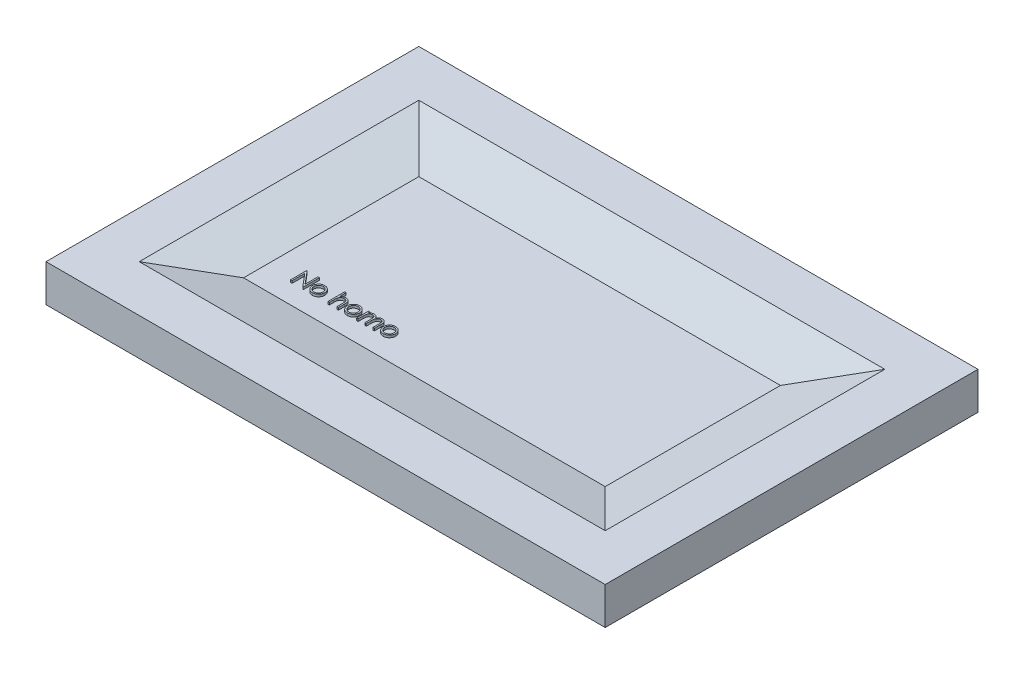
from build123d import *

# Parameters (mm, degrees)
SKETCH1_W            = 120
SKETCH1_H            = 80
BOSS_EXTRUDE1_DEPTH  = 4
CUT_EXTRUDE1_DEPTH   = 3
CUT_EXTRUDE1_DRAFT   = -75
MIRROR1_COPY_1_DEPTH = 3
MIRROR1_COPY_1_DRAFT = -75
BOSS_EXTRUDE3_DEPTH  = 0.5
BOSS_EXTRUDE6_DEPTH  = 0.5


with BuildPart() as part:
    # Sketch1 → Boss-Extrude1 (new, symmetric)
    with BuildSketch(Plane(origin=(0, 0, 0), x_dir=(1, 0, 0), z_dir=(0, 1, 0))):
        Rectangle(SKETCH1_W, SKETCH1_H)
    extrude(amount=BOSS_EXTRUDE1_DEPTH, both=True)


with BuildPart() as cut_extrude1_tool:
    # 3DSketch1 → Cut-Extrude1 (with draft: the straight prism first)
    with BuildSketch(Plane(origin=(-50, 4, 30), x_dir=(0.8574929257125441, 0, -0.5144957554275267), z_dir=(0, 1, 0))):
        Polygon((0, 0), (85.749292571, -51.449575543), (116.619037897, 0), (30.869745326, 51.449575543), align=None)
    extrude(amount=-CUT_EXTRUDE1_DEPTH)
    # Cut-Extrude1: the draft: its side faces are tilted about the plane it starts from
    cut_extrude1_sides = [cut_extrude1_tool.faces().sort_by_distance(p)[0] for p in [
        (0, 2.5, 30),
        (50, 2.5, 0),
        (0, 2.5, -30),
        (-50, 2.5, 0),
    ]]
    draft(cut_extrude1_sides, Plane(origin=(-50, 4, 30), x_dir=(0.8574929257125441, 0, -0.5144957554275267), z_dir=(0, 1, 0)), CUT_EXTRUDE1_DRAFT)


with BuildPart() as part_1:
    add(part.part)

    # Cut-Extrude1: cut by cut_extrude1_tool
    add(cut_extrude1_tool.part, mode=Mode.SUBTRACT)


with BuildPart() as mirror1_copy_1_tool:
    # Mirror1 copy 1 sketch → Mirror1 copy 1 (with draft: the straight prism first)
    with BuildSketch(Plane(origin=(-50, -4, 30), x_dir=(0.8574929257125441, 0, -0.5144957554275267), z_dir=(0, -1, 0))):
        Polygon((0, 0), (85.749292571, 51.449575543), (116.619037897, 0), (30.869745326, -51.449575543), align=None)
    extrude(amount=-MIRROR1_COPY_1_DEPTH)
    # Mirror1 copy 1: the draft: its side faces are tilted about the plane it starts from
    mirror1_copy_1_sides = [mirror1_copy_1_tool.faces().sort_by_distance(p)[0] for p in [
        (0, -2.5, 30),
        (50, -2.5, 0),
        (0, -2.5, -30),
        (-50, -2.5, 0),
    ]]
    draft(mirror1_copy_1_sides, Plane(origin=(-50, -4, 30), x_dir=(0.8574929257125441, 0, -0.5144957554275267), z_dir=(0, -1, 0)), MIRROR1_COPY_1_DRAFT)


with BuildPart() as part_2:
    add(part_1.part)

    # Mirror1 copy 1: cut by mirror1_copy_1_tool
    add(mirror1_copy_1_tool.part, mode=Mode.SUBTRACT)

    # Sketch2 → Boss-Extrude3 (add)
    # profile 1 of 6: a face of its own
    with BuildSketch(Plane(origin=(0, 1, 0), x_dir=(1, 0, 0), z_dir=(0, 1, 0))):
        Polygon((-32.885274871, -14.637435962), (-32.885274871, -11.137435962), (-32.819369422, -11.137435962), (-30.507069743, -13.892143494), (-30.507069743, -11.137435962), (-30.192967179, -11.137435962), (-30.192967179, -14.637435962), (-30.264481602, -14.637435962), (-32.571172307, -11.889038526), (-32.571172307, -14.637435962), align=None)
    # profile 2 of 6: a face of its own
    with BuildSketch(Plane(origin=(0, 1, 0), x_dir=(1, 0, 0), z_dir=(0, 1, 0))):
        with BuildLine():
            add(Edge.make_bspline(
                [(-28.149898269, -12.034871859), (-28.101906996, -12.03589375), (-28.007807838, -12.037897429), (-27.869999952, -12.059312395), (-27.738454816, -12.092059759), (-27.612668624, -12.137331321), (-27.494252329, -12.198013272), (-27.381481085, -12.270422563), (-27.274664076, -12.356205156), (-27.210641047, -12.422563225), (-27.178143461, -12.456246058)],
                knots=[0, 0, 0, 0, 1.054011418, 2.066658804, 3.057071809, 4.030435133, 4.997543892, 5.974964718, 6.972108034, 8, 8, 8, 8], degree=3))
            add(Edge.make_bspline(
                [(-27.178143461, -12.456246058), (-27.150161507, -12.488460043), (-27.094739127, -12.552264586), (-27.023673408, -12.655720199), (-26.962451848, -12.762860299), (-26.913388887, -12.875107626), (-26.874703863, -12.991482297), (-26.847238167, -13.112384308), (-26.830901232, -13.237546655), (-26.828698265, -13.322550493), (-26.827582563, -13.365601026)],
                knots=[0, 0, 0, 0, 1.025258237, 2.030674902, 3.01204498, 3.988269485, 4.97094183, 5.956517959, 6.965070386, 8, 8, 8, 8], degree=3))
            add(Edge.make_bspline(
                [(-26.827582563, -13.365601026), (-26.828563901, -13.408901083), (-26.830503069, -13.494464017), (-26.848846685, -13.620483382), (-26.877377771, -13.742678205), (-26.91820961, -13.860536899), (-26.970567719, -13.974419726), (-27.034458406, -14.083829276), (-27.110330023, -14.188981409), (-27.19633402, -14.288983247), (-27.291385896, -14.381149462), (-27.394502045, -14.461477731), (-27.503656078, -14.530299256), (-27.620299432, -14.585735671), (-27.743366919, -14.629445372), (-27.873123987, -14.660145388), (-28.009369057, -14.678707072), (-28.102396278, -14.681090645), (-28.149898269, -14.682307756)],
                knots=[0, 0, 0, 0, 0.998656419, 1.973391657, 2.932242238, 3.890759089, 4.846373663, 5.82037756, 6.809684879, 7.83454468, 8.860553229, 9.859544525, 10.845671541, 11.83227036, 12.833544569, 13.85385346, 14.904124723, 16, 16, 16, 16], degree=3))
            add(Edge.make_bspline(
                [(-28.149898269, -14.682307756), (-28.197632988, -14.68108656), (-28.291123848, -14.678694786), (-28.42784983, -14.660217503), (-28.557839449, -14.62945952), (-28.681068047, -14.585592028), (-28.798212894, -14.530297484), (-28.907999391, -14.461685794), (-29.011199307, -14.381125639), (-29.106271291, -14.288989702), (-29.192269896, -14.188979746), (-29.268142905, -14.083829707), (-29.332033231, -13.974419614), (-29.384391435, -13.860536929), (-29.425223248, -13.742678197), (-29.45375434, -13.620483385), (-29.472097955, -13.494464016), (-29.474037123, -13.408901083), (-29.475018461, -13.365601026)],
                knots=[0, 0, 0, 0, 1.099876186, 2.154163076, 3.173186993, 4.173200201, 5.163417411, 6.152872554, 7.150605724, 8.17532212, 9.198891216, 10.186952605, 11.159729845, 12.11414092, 13.071450619, 14.029093627, 15.002601286, 16, 16, 16, 16], degree=3))
            add(Edge.make_bspline(
                [(-29.475018461, -13.365601026), (-29.473895151, -13.32278448), (-29.471671189, -13.238015077), (-29.45535068, -13.113088017), (-29.427992124, -12.992390628), (-29.389260727, -12.876465152), (-29.339745536, -12.764709716), (-29.279384248, -12.657304885), (-29.207593616, -12.554317084), (-29.152391664, -12.490595004), (-29.124457563, -12.458349423)],
                knots=[0, 0, 0, 0, 1.031353054, 2.041901799, 3.029428768, 4.008703097, 4.981709435, 5.96992636, 6.972712378, 8, 8, 8, 8], degree=3))
            add(Edge.make_bspline(
                [(-29.124457563, -12.458349423), (-29.092008972, -12.424374484), (-29.028193109, -12.357556788), (-28.920844381, -12.272024263), (-28.80835056, -12.19810819), (-28.688625634, -12.138631974), (-28.562942776, -12.091793456), (-28.430723533, -12.059227941), (-28.292448018, -12.037974586), (-28.197888397, -12.035916409), (-28.149898269, -12.034871859)],
                knots=[0, 0, 0, 0, 1.027980169, 2.021703884, 2.998553061, 3.971491411, 4.943284454, 5.930300938, 6.949603206, 8, 8, 8, 8], degree=3))
        make_face()
        with BuildLine():
            add(Edge.make_bspline(
                [(-28.151300512, -12.348974423), (-28.185238124, -12.349939015), (-28.252237252, -12.351843297), (-28.350856837, -12.366327202), (-28.445796991, -12.389274706), (-28.537237835, -12.421878762), (-28.624871007, -12.463977661), (-28.70878041, -12.515686021), (-28.78921285, -12.576318978), (-28.864594913, -12.64578165), (-28.933777225, -12.721660644), (-28.994255202, -12.802509003), (-29.045680308, -12.887015349), (-29.088520467, -12.97526756), (-29.120427655, -13.068159974), (-29.143600678, -13.164640605), (-29.158070918, -13.264906022), (-29.159957297, -13.33306704), (-29.160915897, -13.367704391)],
                knots=[0, 0, 0, 0, 1.021534396, 2.016698045, 2.994645724, 3.958388632, 4.93408049, 5.916473867, 6.921342795, 7.962252576, 8.998418191, 10.008913653, 10.997312074, 11.973003931, 12.956656626, 13.948281152, 14.957379055, 16, 16, 16, 16], degree=3))
            add(Edge.make_bspline(
                [(-29.160915897, -13.367704391), (-29.159309073, -13.412456418), (-29.156119829, -13.501280824), (-29.130184592, -13.632091946), (-29.086798312, -13.757673798), (-29.028211033, -13.877290184), (-28.954804814, -13.987962463), (-28.868317747, -14.086633947), (-28.769678047, -14.171819758), (-28.660061547, -14.242500604), (-28.541707229, -14.29866036), (-28.416450908, -14.338459335), (-28.285810214, -14.364331028), (-28.196529483, -14.366902502), (-28.151300512, -14.368205192)],
                knots=[0, 0, 0, 0, 1.016792936, 2.018143844, 3.017858371, 4.030088057, 5.03801393, 6.028138512, 7.003788237, 7.991172063, 8.984598303, 9.972568034, 10.972917682, 12, 12, 12, 12], degree=3))
            add(Edge.make_bspline(
                [(-28.151300512, -14.368205192), (-28.106074143, -14.366894912), (-28.016798547, -14.364308455), (-27.88633937, -14.338589635), (-27.761425399, -14.298485975), (-27.643194011, -14.242563765), (-27.533627408, -14.17155135), (-27.434278286, -14.087114973), (-27.348529675, -13.987701122), (-27.27519607, -13.877143593), (-27.215649328, -13.757859241), (-27.172466126, -13.632068768), (-27.14646854, -13.501286727), (-27.143287711, -13.412458396), (-27.141685128, -13.367704391)],
                knots=[0, 0, 0, 0, 1.02726834, 2.027799167, 3.010890988, 4.004497153, 4.992059811, 5.971914811, 6.958719428, 7.966827853, 8.981595046, 9.981490638, 10.983022906, 12, 12, 12, 12], degree=3))
            add(Edge.make_bspline(
                [(-27.141685128, -13.367704391), (-27.142643398, -13.333066833), (-27.144529127, -13.264905408), (-27.159004091, -13.164642954), (-27.182159631, -13.068151357), (-27.214131248, -12.975299354), (-27.256785262, -12.88678685), (-27.309202055, -12.802757123), (-27.36943308, -12.721380577), (-27.439450201, -12.646026936), (-27.514753579, -12.576291899), (-27.595218617, -12.51566251), (-27.679003596, -12.464204914), (-27.766382179, -12.421518674), (-27.857834746, -12.389571334), (-27.952641875, -12.366194702), (-28.050840685, -12.351904505), (-28.117599728, -12.349957364), (-28.151300512, -12.348974423)],
                knots=[0, 0, 0, 0, 1.042956736, 2.052379634, 3.044323526, 4.02829302, 5.004299113, 5.996692471, 7.007513377, 8.048758398, 9.090003419, 10.095195979, 11.07790575, 12.047570684, 13.018257071, 13.989683339, 14.985167495, 16, 16, 16, 16], degree=3))
        make_face(mode=Mode.SUBTRACT)
    # profile 3 of 6: a face of its own
    with BuildSketch(Plane(origin=(0, 1, 0), x_dir=(1, 0, 0), z_dir=(0, 1, 0))):
        with BuildLine():
            Line((-24.853223589, -11.047692372), (-24.539121025, -11.047692372))
            Line((-24.539121025, -11.047692372), (-24.539121025, -12.56281657))
            add(Edge.make_bspline(
                [(-24.539121025, -12.56281657), (-24.505403723, -12.520672588), (-24.439754409, -12.438616096), (-24.329258293, -12.331554905), (-24.215787421, -12.238756284), (-24.095422611, -12.164885826), (-23.97037209, -12.106529283), (-23.840108446, -12.065141637), (-23.704607475, -12.03969054), (-23.612582325, -12.036492122), (-23.565963974, -12.034871859)],
                knots=[0, 0, 0, 0, 1.125788106, 2.19196713, 3.20547328, 4.180437432, 5.132270164, 6.079753143, 7.027236121, 8, 8, 8, 8], degree=3))
            add(Edge.make_bspline(
                [(-23.565963974, -12.034871859), (-23.518633581, -12.036617289), (-23.425996585, -12.040033517), (-23.291115123, -12.067046898), (-23.165154248, -12.113204336), (-23.048488405, -12.176371361), (-22.943663708, -12.255044189), (-22.850813944, -12.345875711), (-22.774973145, -12.451149629), (-22.723374028, -12.548405883), (-22.68980062, -12.634944637), (-22.668548794, -12.70918115), (-22.650529595, -12.791903063), (-22.63482986, -12.883067795), (-22.624366278, -12.983112967), (-22.61596166, -13.091587221), (-22.609985206, -13.208484339), (-22.609753601, -13.289404588), (-22.609633846, -13.331246058)],
                knots=[0, 0, 0, 0, 1.235656852, 2.418478516, 3.575258207, 4.727955599, 5.870717718, 6.98870536, 8.107142894, 9.245821548, 9.854588956, 10.528768408, 11.260415777, 12.065282286, 12.943670737, 13.886611085, 14.907229059, 16, 16, 16, 16], degree=3))
            Line((-22.609633846, -13.331246058), (-22.609633846, -14.637435962))
            Line((-22.609633846, -14.637435962), (-22.92373641, -14.637435962))
            Line((-22.92373641, -14.637435962), (-22.92373641, -13.434310962))
            add(Edge.make_bspline(
                [(-22.92373641, -13.434310962), (-22.923926713, -13.399488292), (-22.92429073, -13.332878452), (-22.925494075, -13.237512343), (-22.92818029, -13.151016209), (-22.932521116, -13.073667257), (-22.937086423, -13.005357654), (-22.943369741, -12.946186599), (-22.950679975, -12.896072824), (-22.957248756, -12.865908195), (-22.960194743, -12.852379872)],
                knots=[0, 0, 0, 0, 1.430932559, 2.737130458, 3.918967929, 4.986496826, 5.920444988, 6.731744033, 7.431208747, 8, 8, 8, 8], degree=3))
            add(Edge.make_bspline(
                [(-22.960194743, -12.852379872), (-22.971618988, -12.812685608), (-22.993582033, -12.736373617), (-23.04463001, -12.632711207), (-23.108389021, -12.544326467), (-23.186236283, -12.472412178), (-23.276794647, -12.416000639), (-23.380654611, -12.376932857), (-23.496838679, -12.352685135), (-23.578690151, -12.350245831), (-23.621352596, -12.348974423)],
                knots=[0, 0, 0, 0, 1.090059168, 2.095632401, 3.037101401, 3.955032261, 4.878929692, 5.839099886, 6.873700383, 8, 8, 8, 8], degree=3))
            add(Edge.make_bspline(
                [(-23.621352596, -12.348974423), (-23.646620369, -12.349450249), (-23.696624639, -12.350391897), (-23.770773305, -12.359845796), (-23.842702368, -12.375294514), (-23.913104546, -12.396199053), (-23.980487744, -12.42464459), (-24.046816069, -12.457574779), (-24.110210278, -12.497883034), (-24.171796095, -12.543108801), (-24.229113628, -12.593178561), (-24.282440743, -12.646025516), (-24.329979084, -12.70230048), (-24.373047675, -12.761100596), (-24.41022596, -12.82323239), (-24.442679042, -12.888096708), (-24.470214739, -12.955778854), (-24.483897431, -13.002753916), (-24.490743621, -13.026258077)],
                knots=[0, 0, 0, 0, 1.024319606, 2.027102035, 3.025350316, 4.005802111, 5.00026367, 5.987881639, 7.005602596, 8.042517216, 9.083927026, 10.089214625, 11.084353441, 12.06828073, 13.041928858, 14.016821737, 15.00770877, 16, 16, 16, 16], degree=3))
            add(Edge.make_bspline(
                [(-24.490743621, -13.026258077), (-24.494683048, -13.043279028), (-24.503267545, -13.080369775), (-24.512582379, -13.141544099), (-24.520920175, -13.212630471), (-24.527968725, -13.293521071), (-24.532291811, -13.384512313), (-24.536950052, -13.484983272), (-24.538684066, -13.595563293), (-24.538971019, -13.672458801), (-24.539121025, -13.712656314)],
                knots=[0, 0, 0, 0, 0.607992626, 1.324890765, 2.152360218, 3.099583803, 4.150613268, 5.323148443, 6.60066238, 8, 8, 8, 8], degree=3))
            Line((-24.539121025, -13.712656314), (-24.539121025, -14.637435962))
            Line((-24.539121025, -14.637435962), (-24.853223589, -14.637435962))
            Line((-24.853223589, -14.637435962), (-24.853223589, -11.047692372))
        make_face()
    # profile 4 of 6: a face of its own
    with BuildSketch(Plane(origin=(0, 1, 0), x_dir=(1, 0, 0), z_dir=(0, 1, 0))):
        with BuildLine():
            add(Edge.make_bspline(
                [(-20.656308525, -12.034871859), (-20.608317252, -12.03589375), (-20.514218095, -12.037897429), (-20.376410209, -12.059312395), (-20.244865073, -12.092059759), (-20.119078881, -12.137331321), (-20.000662585, -12.198013272), (-19.887891341, -12.270422563), (-19.781074332, -12.356205156), (-19.717051303, -12.422563225), (-19.684553717, -12.456246058)],
                knots=[0, 0, 0, 0, 1.054011418, 2.066658804, 3.057071809, 4.030435133, 4.997543892, 5.974964718, 6.972108034, 8, 8, 8, 8], degree=3))
            add(Edge.make_bspline(
                [(-19.684553717, -12.456246058), (-19.656571763, -12.488460043), (-19.601149383, -12.552264586), (-19.530083664, -12.655720199), (-19.468862104, -12.762860299), (-19.419799143, -12.875107626), (-19.381114119, -12.991482297), (-19.353648423, -13.112384308), (-19.337311488, -13.237546655), (-19.335108521, -13.322550493), (-19.33399282, -13.365601026)],
                knots=[0, 0, 0, 0, 1.025258237, 2.030674902, 3.01204498, 3.988269485, 4.97094183, 5.956517959, 6.965070386, 8, 8, 8, 8], degree=3))
            add(Edge.make_bspline(
                [(-19.33399282, -13.365601026), (-19.334974157, -13.408901083), (-19.336913326, -13.494464017), (-19.355256942, -13.620483382), (-19.383788028, -13.742678205), (-19.424619866, -13.860536899), (-19.476977975, -13.974419726), (-19.540868663, -14.083829276), (-19.61674028, -14.188981409), (-19.702744277, -14.288983247), (-19.797796153, -14.381149462), (-19.900912301, -14.461477731), (-20.010066335, -14.530299256), (-20.126709688, -14.585735671), (-20.249777175, -14.629445372), (-20.379534243, -14.660145388), (-20.515779313, -14.678707072), (-20.608806535, -14.681090645), (-20.656308525, -14.682307756)],
                knots=[0, 0, 0, 0, 0.998656419, 1.973391657, 2.932242238, 3.890759089, 4.846373663, 5.82037756, 6.809684879, 7.83454468, 8.860553229, 9.859544525, 10.845671541, 11.83227036, 12.833544569, 13.85385346, 14.904124723, 16, 16, 16, 16], degree=3))
            add(Edge.make_bspline(
                [(-20.656308525, -14.682307756), (-20.704043245, -14.68108656), (-20.797534104, -14.678694786), (-20.934260086, -14.660217503), (-21.064249705, -14.62945952), (-21.187478304, -14.585592028), (-21.304623151, -14.530297484), (-21.414409648, -14.461685794), (-21.517609563, -14.381125639), (-21.612681547, -14.288989702), (-21.698680153, -14.188979746), (-21.774553161, -14.083829707), (-21.838443487, -13.974419614), (-21.890801691, -13.860536929), (-21.931633504, -13.742678197), (-21.960164597, -13.620483385), (-21.978508211, -13.494464016), (-21.98044738, -13.408901083), (-21.981428717, -13.365601026)],
                knots=[0, 0, 0, 0, 1.099876186, 2.154163076, 3.173186993, 4.173200201, 5.163417411, 6.152872554, 7.150605724, 8.17532212, 9.198891216, 10.186952605, 11.159729845, 12.11414092, 13.071450619, 14.029093627, 15.002601286, 16, 16, 16, 16], degree=3))
            add(Edge.make_bspline(
                [(-21.981428717, -13.365601026), (-21.980305407, -13.32278448), (-21.978081446, -13.238015077), (-21.961760936, -13.113088017), (-21.93440238, -12.992390628), (-21.895670984, -12.876465152), (-21.846155793, -12.764709716), (-21.785794505, -12.657304885), (-21.714003872, -12.554317084), (-21.658801921, -12.490595004), (-21.63086782, -12.458349423)],
                knots=[0, 0, 0, 0, 1.031353054, 2.041901799, 3.029428768, 4.008703097, 4.981709435, 5.96992636, 6.972712378, 8, 8, 8, 8], degree=3))
            add(Edge.make_bspline(
                [(-21.63086782, -12.458349423), (-21.598419229, -12.424374484), (-21.534603365, -12.357556788), (-21.427254637, -12.272024263), (-21.314760816, -12.19810819), (-21.19503589, -12.138631974), (-21.069353032, -12.091793456), (-20.93713379, -12.059227941), (-20.798858274, -12.037974586), (-20.704298653, -12.035916409), (-20.656308525, -12.034871859)],
                knots=[0, 0, 0, 0, 1.027980169, 2.021703884, 2.998553061, 3.971491411, 4.943284454, 5.930300938, 6.949603206, 8, 8, 8, 8], degree=3))
        make_face()
        with BuildLine():
            add(Edge.make_bspline(
                [(-20.657710769, -12.348974423), (-20.69164838, -12.349939015), (-20.758647509, -12.351843297), (-20.857267093, -12.366327202), (-20.952207247, -12.389274706), (-21.043648091, -12.421878762), (-21.131281264, -12.463977661), (-21.215190666, -12.515686021), (-21.295623106, -12.576318978), (-21.371005169, -12.64578165), (-21.440187482, -12.721660644), (-21.500665458, -12.802509003), (-21.552090565, -12.887015349), (-21.594930724, -12.97526756), (-21.626837912, -13.068159974), (-21.650010934, -13.164640605), (-21.664481175, -13.264906022), (-21.666367553, -13.33306704), (-21.667326153, -13.367704391)],
                knots=[0, 0, 0, 0, 1.021534396, 2.016698045, 2.994645724, 3.958388632, 4.93408049, 5.916473867, 6.921342795, 7.962252576, 8.998418191, 10.008913653, 10.997312074, 11.973003931, 12.956656626, 13.948281152, 14.957379055, 16, 16, 16, 16], degree=3))
            add(Edge.make_bspline(
                [(-21.667326153, -13.367704391), (-21.66571933, -13.412456418), (-21.662530085, -13.501280824), (-21.636594849, -13.632091946), (-21.593208569, -13.757673798), (-21.534621289, -13.877290184), (-21.46121507, -13.987962463), (-21.374728004, -14.086633947), (-21.276088303, -14.171819758), (-21.166471803, -14.242500604), (-21.048117485, -14.29866036), (-20.922861164, -14.338459335), (-20.79222047, -14.364331028), (-20.702939739, -14.366902502), (-20.657710769, -14.368205192)],
                knots=[0, 0, 0, 0, 1.016792936, 2.018143844, 3.017858371, 4.030088057, 5.03801393, 6.028138512, 7.003788237, 7.991172063, 8.984598303, 9.972568034, 10.972917682, 12, 12, 12, 12], degree=3))
            add(Edge.make_bspline(
                [(-20.657710769, -14.368205192), (-20.6124844, -14.366894912), (-20.523208804, -14.364308455), (-20.392749627, -14.338589635), (-20.267835655, -14.298485975), (-20.149604267, -14.242563765), (-20.040037664, -14.17155135), (-19.940688543, -14.087114973), (-19.854939932, -13.987701122), (-19.781606327, -13.877143593), (-19.722059584, -13.757859241), (-19.678876382, -13.632068768), (-19.652878796, -13.501286727), (-19.649697968, -13.412458396), (-19.648095384, -13.367704391)],
                knots=[0, 0, 0, 0, 1.02726834, 2.027799167, 3.010890988, 4.004497153, 4.992059811, 5.971914811, 6.958719428, 7.966827853, 8.981595046, 9.981490638, 10.983022906, 12, 12, 12, 12], degree=3))
            add(Edge.make_bspline(
                [(-19.648095384, -13.367704391), (-19.649053654, -13.333066833), (-19.650939383, -13.264905408), (-19.665414348, -13.164642954), (-19.688569887, -13.068151357), (-19.720541504, -12.975299354), (-19.763195518, -12.88678685), (-19.815612311, -12.802757123), (-19.875843337, -12.721380577), (-19.945860458, -12.646026936), (-20.021163836, -12.576291899), (-20.101628874, -12.51566251), (-20.185413852, -12.464204914), (-20.272792435, -12.421518674), (-20.364245003, -12.389571334), (-20.459052132, -12.366194702), (-20.557250942, -12.351904505), (-20.624009985, -12.349957364), (-20.657710769, -12.348974423)],
                knots=[0, 0, 0, 0, 1.042956736, 2.052379634, 3.044323526, 4.02829302, 5.004299113, 5.996692471, 7.007513377, 8.048758398, 9.090003419, 10.095195979, 11.07790575, 12.047570684, 13.018257071, 13.989683339, 14.985167495, 16, 16, 16, 16], degree=3))
        make_face(mode=Mode.SUBTRACT)
    # profile 5 of 6: a face of its own
    with BuildSketch(Plane(origin=(0, 1, 0), x_dir=(1, 0, 0), z_dir=(0, 1, 0))):
        with BuildLine():
            Line((-18.705787692, -12.079743654), (-18.391685128, -12.079743654))
            Line((-18.391685128, -12.079743654), (-18.391685128, -12.524254872))
            add(Edge.make_bspline(
                [(-18.391685128, -12.524254872), (-18.363401178, -12.48536727), (-18.309206418, -12.410854897), (-18.220340766, -12.312664613), (-18.131564653, -12.229336458), (-18.067631271, -12.185593586), (-18.036917499, -12.164579391)],
                knots=[0, 0, 0, 0, 1.134379233, 2.173579362, 3.122582517, 4, 4, 4, 4], degree=3))
            add(Edge.make_bspline(
                [(-18.036917499, -12.164579391), (-17.995052837, -12.144574026), (-17.912054937, -12.104912812), (-17.780635713, -12.064679253), (-17.646161043, -12.039954152), (-17.555352829, -12.036572779), (-17.50967391, -12.034871859)],
                knots=[0, 0, 0, 0, 1.014936303, 2.012140481, 3.000054389, 4, 4, 4, 4], degree=3))
            add(Edge.make_bspline(
                [(-17.50967391, -12.034871859), (-17.478780913, -12.03591715), (-17.417645334, -12.037985724), (-17.327061244, -12.051445759), (-17.239202632, -12.074711932), (-17.154588603, -12.107119256), (-17.074867923, -12.146365943), (-17.001778726, -12.192415651), (-16.936154518, -12.244112726), (-16.878028466, -12.303791659), (-16.825759441, -12.373128258), (-16.777680594, -12.453992507), (-16.733255382, -12.548200168), (-16.708634073, -12.616566709), (-16.695671506, -12.65256016)],
                knots=[0, 0, 0, 0, 1.009824226, 1.998387844, 2.986035974, 3.974953746, 4.955485308, 5.885931332, 6.793869504, 7.679848016, 8.601185859, 9.625726857, 10.749998409, 12, 12, 12, 12], degree=3))
            add(Edge.make_bspline(
                [(-16.695671506, -12.65256016), (-16.681960254, -12.627835741), (-16.654978437, -12.579181556), (-16.6096728, -12.510323294), (-16.562205004, -12.445916502), (-16.512170511, -12.385910078), (-16.459745924, -12.330600347), (-16.404684524, -12.279804445), (-16.347299742, -12.233304232), (-16.267507502, -12.178981072), (-16.163694895, -12.121279891), (-16.03280678, -12.071251447), (-15.896656609, -12.040335319), (-15.80423891, -12.036705046), (-15.757570544, -12.034871859)],
                knots=[0, 0, 0, 0, 0.86119277, 1.694706429, 2.50939023, 3.298075842, 4.073795165, 4.829715201, 5.57930267, 6.321991688, 7.768977793, 9.186738141, 10.579381044, 12, 12, 12, 12], degree=3))
            add(Edge.make_bspline(
                [(-15.757570544, -12.034871859), (-15.714689081, -12.03648908), (-15.630765895, -12.039654138), (-15.508588629, -12.064507611), (-15.394646824, -12.107185258), (-15.289169748, -12.165418895), (-15.194009935, -12.238598078), (-15.111293625, -12.325666916), (-15.041523262, -12.426009539), (-14.995944622, -12.520401528), (-14.965029358, -12.603736861), (-14.945968124, -12.674743152), (-14.929128429, -12.752894705), (-14.915147183, -12.838284966), (-14.904928631, -12.931215575), (-14.897357916, -13.03153445), (-14.892233842, -13.139319562), (-14.89187177, -13.213685062), (-14.891685128, -13.252019295)],
                knots=[0, 0, 0, 0, 1.209669288, 2.367440248, 3.500751976, 4.631527125, 5.755587489, 6.87532382, 8.007944318, 9.190864318, 9.82315674, 10.514484317, 11.263564316, 12.079023757, 12.955305781, 13.901327259, 14.918167583, 16, 16, 16, 16], degree=3))
            Line((-14.891685128, -13.252019295), (-14.891685128, -14.637435962))
            Line((-14.891685128, -14.637435962), (-15.205787692, -14.637435962))
            Line((-15.205787692, -14.637435962), (-15.205787692, -13.250617051))
            add(Edge.make_bspline(
                [(-15.205787692, -13.250617051), (-15.205865575, -13.217896477), (-15.206015254, -13.15501251), (-15.208708885, -13.064760059), (-15.2137842, -12.982491702), (-15.219718838, -12.908319614), (-15.227962648, -12.842070825), (-15.238608579, -12.783878407), (-15.249886259, -12.733284595), (-15.26862225, -12.677198548), (-15.298570142, -12.615328337), (-15.344187622, -12.548604762), (-15.401657728, -12.490523961), (-15.468017885, -12.440105645), (-15.54356633, -12.399112003), (-15.626831053, -12.369835994), (-15.717295104, -12.351713115), (-15.779917893, -12.3499071), (-15.812258044, -12.348974423)],
                knots=[0, 0, 0, 0, 1.253487763, 2.409012846, 3.458416907, 4.410876679, 5.259312806, 6.014470957, 6.676830364, 7.243083969, 8.276244668, 9.299465089, 10.325150304, 11.392391894, 12.482080715, 13.603491619, 14.762376348, 16, 16, 16, 16], degree=3))
            add(Edge.make_bspline(
                [(-15.812258044, -12.348974423), (-15.851927999, -12.35039058), (-15.93033091, -12.353189446), (-16.044776396, -12.381763319), (-16.154747413, -12.424843569), (-16.256962546, -12.487276027), (-16.350990336, -12.56208439), (-16.431889914, -12.651033986), (-16.4987221, -12.751663913), (-16.543976076, -12.844810615), (-16.572565377, -12.928480059), (-16.591442293, -13.001577431), (-16.606125684, -13.084658999), (-16.619896213, -13.17716649), (-16.628883941, -13.27973667), (-16.637052314, -13.391895071), (-16.640873176, -13.513979031), (-16.641407635, -13.598605719), (-16.641685128, -13.642544135)],
                knots=[0, 0, 0, 0, 1.090531906, 2.155305635, 3.229839962, 4.33261226, 5.44038871, 6.529323825, 7.629011124, 8.757537029, 9.370236727, 10.061839251, 10.834451254, 11.692844982, 12.636905849, 13.66920014, 14.789842145, 16, 16, 16, 16], degree=3))
            Line((-16.641685128, -13.642544135), (-16.641685128, -14.637435962))
            Line((-16.641685128, -14.637435962), (-16.955787692, -14.637435962))
            Line((-16.955787692, -14.637435962), (-16.955787692, -13.336855032))
            add(Edge.make_bspline(
                [(-16.955787692, -13.336855032), (-16.955867123, -13.300161713), (-16.95601994, -13.229567456), (-16.958696257, -13.128333781), (-16.963782879, -13.036252701), (-16.969663427, -12.953431237), (-16.978123606, -12.880019908), (-16.987733368, -12.81562515), (-16.999081978, -12.760408399), (-17.017871863, -12.699845014), (-17.046586331, -12.633124091), (-17.092774593, -12.56198307), (-17.150382174, -12.499714972), (-17.21795305, -12.446556224), (-17.293958732, -12.402614743), (-17.377942133, -12.370954991), (-17.469147045, -12.352530701), (-17.532024751, -12.350182205), (-17.56436141, -12.348974423)],
                knots=[0, 0, 0, 0, 1.320475261, 2.540461679, 3.643808994, 4.639130445, 5.527981419, 6.302341397, 6.981980563, 7.553956391, 8.582137848, 9.585246428, 10.591171744, 11.620968678, 12.668337649, 13.738356861, 14.836885341, 16, 16, 16, 16], degree=3))
            add(Edge.make_bspline(
                [(-17.56436141, -12.348974423), (-17.602377621, -12.350504883), (-17.67814258, -12.353555036), (-17.78944455, -12.381009309), (-17.896930234, -12.424013384), (-17.998884933, -12.483673203), (-18.092559081, -12.557572282), (-18.174567348, -12.644487178), (-18.243509874, -12.743336211), (-18.289241689, -12.835500728), (-18.318740163, -12.917074003), (-18.338335497, -12.98642495), (-18.355175123, -13.063425198), (-18.367689145, -13.14831231), (-18.379769561, -13.240533404), (-18.38559987, -13.340547893), (-18.391271432, -13.448269981), (-18.391543846, -13.522642526), (-18.391685128, -13.561214006)],
                knots=[0, 0, 0, 0, 1.098833095, 2.189935336, 3.297829714, 4.440610912, 5.596351641, 6.740013378, 7.886572111, 9.072425424, 9.705826452, 10.395263256, 11.156850408, 11.985370555, 12.878090359, 13.847760091, 14.883794034, 16, 16, 16, 16], degree=3))
            Line((-18.391685128, -13.561214006), (-18.391685128, -14.637435962))
            Line((-18.391685128, -14.637435962), (-18.705787692, -14.637435962))
            Line((-18.705787692, -14.637435962), (-18.705787692, -12.079743654))
        make_face()
    # profile 6 of 6: a face of its own
    with BuildSketch(Plane(origin=(0, 1, 0), x_dir=(1, 0, 0), z_dir=(0, 1, 0))):
        with BuildLine():
            add(Edge.make_bspline(
                [(-12.938359807, -12.034871859), (-12.890368534, -12.03589375), (-12.796269377, -12.037897429), (-12.658461491, -12.059312395), (-12.526916355, -12.092059759), (-12.401130163, -12.137331321), (-12.282713867, -12.198013272), (-12.169942623, -12.270422563), (-12.063125614, -12.356205156), (-11.999102585, -12.422563225), (-11.966604999, -12.456246058)],
                knots=[0, 0, 0, 0, 1.054011418, 2.066658804, 3.057071809, 4.030435133, 4.997543892, 5.974964718, 6.972108034, 8, 8, 8, 8], degree=3))
            add(Edge.make_bspline(
                [(-11.966604999, -12.456246058), (-11.938623045, -12.488460043), (-11.883200665, -12.552264586), (-11.812134946, -12.655720199), (-11.750913386, -12.762860299), (-11.701850425, -12.875107626), (-11.663165401, -12.991482297), (-11.635699705, -13.112384308), (-11.61936277, -13.237546655), (-11.617159803, -13.322550493), (-11.616044102, -13.365601026)],
                knots=[0, 0, 0, 0, 1.025258237, 2.030674902, 3.01204498, 3.988269485, 4.97094183, 5.956517959, 6.965070386, 8, 8, 8, 8], degree=3))
            add(Edge.make_bspline(
                [(-11.616044102, -13.365601026), (-11.617025439, -13.408901083), (-11.618964608, -13.494464017), (-11.637308224, -13.620483382), (-11.66583931, -13.742678205), (-11.706671148, -13.860536899), (-11.759029257, -13.974419726), (-11.822919945, -14.083829276), (-11.898791562, -14.188981409), (-11.984795559, -14.288983247), (-12.079847435, -14.381149462), (-12.182963583, -14.461477731), (-12.292117617, -14.530299256), (-12.40876097, -14.585735671), (-12.531828457, -14.629445372), (-12.661585525, -14.660145388), (-12.797830595, -14.678707072), (-12.890857817, -14.681090645), (-12.938359807, -14.682307756)],
                knots=[0, 0, 0, 0, 0.998656419, 1.973391657, 2.932242238, 3.890759089, 4.846373663, 5.82037756, 6.809684879, 7.83454468, 8.860553229, 9.859544525, 10.845671541, 11.83227036, 12.833544569, 13.85385346, 14.904124723, 16, 16, 16, 16], degree=3))
            add(Edge.make_bspline(
                [(-12.938359807, -14.682307756), (-12.986094527, -14.68108656), (-13.079585386, -14.678694786), (-13.216311368, -14.660217503), (-13.346300987, -14.62945952), (-13.469529586, -14.585592028), (-13.586674433, -14.530297484), (-13.69646093, -14.461685794), (-13.799660845, -14.381125639), (-13.89473283, -14.288989702), (-13.980731435, -14.188979746), (-14.056604443, -14.083829707), (-14.120494769, -13.974419614), (-14.172852973, -13.860536929), (-14.213684786, -13.742678197), (-14.242215879, -13.620483385), (-14.260559493, -13.494464016), (-14.262498662, -13.408901083), (-14.263479999, -13.365601026)],
                knots=[0, 0, 0, 0, 1.099876186, 2.154163076, 3.173186993, 4.173200201, 5.163417411, 6.152872554, 7.150605724, 8.17532212, 9.198891216, 10.186952605, 11.159729845, 12.11414092, 13.071450619, 14.029093627, 15.002601286, 16, 16, 16, 16], degree=3))
            add(Edge.make_bspline(
                [(-14.263479999, -13.365601026), (-14.262356689, -13.32278448), (-14.260132728, -13.238015077), (-14.243812218, -13.113088017), (-14.216453662, -12.992390628), (-14.177722266, -12.876465152), (-14.128207075, -12.764709716), (-14.067845787, -12.657304885), (-13.996055154, -12.554317084), (-13.940853203, -12.490595004), (-13.912919102, -12.458349423)],
                knots=[0, 0, 0, 0, 1.031353054, 2.041901799, 3.029428768, 4.008703097, 4.981709435, 5.96992636, 6.972712378, 8, 8, 8, 8], degree=3))
            add(Edge.make_bspline(
                [(-13.912919102, -12.458349423), (-13.880470511, -12.424374484), (-13.816654647, -12.357556788), (-13.709305919, -12.272024263), (-13.596812098, -12.19810819), (-13.477087172, -12.138631974), (-13.351404314, -12.091793456), (-13.219185072, -12.059227941), (-13.080909556, -12.037974586), (-12.986349935, -12.035916409), (-12.938359807, -12.034871859)],
                knots=[0, 0, 0, 0, 1.027980169, 2.021703884, 2.998553061, 3.971491411, 4.943284454, 5.930300938, 6.949603206, 8, 8, 8, 8], degree=3))
        make_face()
        with BuildLine():
            add(Edge.make_bspline(
                [(-12.939762051, -12.348974423), (-12.973699662, -12.349939015), (-13.040698791, -12.351843297), (-13.139318375, -12.366327202), (-13.234258529, -12.389274706), (-13.325699373, -12.421878762), (-13.413332546, -12.463977661), (-13.497241948, -12.515686021), (-13.577674388, -12.576318978), (-13.653056452, -12.64578165), (-13.722238764, -12.721660644), (-13.78271674, -12.802509003), (-13.834141847, -12.887015349), (-13.876982006, -12.97526756), (-13.908889194, -13.068159974), (-13.932062216, -13.164640605), (-13.946532457, -13.264906022), (-13.948418835, -13.33306704), (-13.949377435, -13.367704391)],
                knots=[0, 0, 0, 0, 1.021534396, 2.016698045, 2.994645724, 3.958388632, 4.93408049, 5.916473867, 6.921342795, 7.962252576, 8.998418191, 10.008913653, 10.997312074, 11.973003931, 12.956656626, 13.948281152, 14.957379055, 16, 16, 16, 16], degree=3))
            add(Edge.make_bspline(
                [(-13.949377435, -13.367704391), (-13.947770612, -13.412456418), (-13.944581367, -13.501280824), (-13.918646131, -13.632091946), (-13.875259851, -13.757673798), (-13.816672571, -13.877290184), (-13.743266352, -13.987962463), (-13.656779286, -14.086633947), (-13.558139585, -14.171819758), (-13.448523085, -14.242500604), (-13.330168767, -14.29866036), (-13.204912446, -14.338459335), (-13.074271752, -14.364331028), (-12.984991021, -14.366902502), (-12.939762051, -14.368205192)],
                knots=[0, 0, 0, 0, 1.016792936, 2.018143844, 3.017858371, 4.030088057, 5.03801393, 6.028138512, 7.003788237, 7.991172063, 8.984598303, 9.972568034, 10.972917682, 12, 12, 12, 12], degree=3))
            add(Edge.make_bspline(
                [(-12.939762051, -14.368205192), (-12.894535682, -14.366894912), (-12.805260086, -14.364308455), (-12.674800909, -14.338589635), (-12.549886937, -14.298485975), (-12.43165555, -14.242563765), (-12.322088946, -14.17155135), (-12.222739825, -14.087114973), (-12.136991214, -13.987701122), (-12.063657609, -13.877143593), (-12.004110866, -13.757859241), (-11.960927664, -13.632068768), (-11.934930078, -13.501286727), (-11.93174925, -13.412458396), (-11.930146666, -13.367704391)],
                knots=[0, 0, 0, 0, 1.02726834, 2.027799167, 3.010890988, 4.004497153, 4.992059811, 5.971914811, 6.958719428, 7.966827853, 8.981595046, 9.981490638, 10.983022906, 12, 12, 12, 12], degree=3))
            add(Edge.make_bspline(
                [(-11.930146666, -13.367704391), (-11.931104936, -13.333066833), (-11.932990665, -13.264905408), (-11.94746563, -13.164642954), (-11.970621169, -13.068151357), (-12.002592786, -12.975299354), (-12.0452468, -12.88678685), (-12.097663593, -12.802757123), (-12.157894619, -12.721380577), (-12.22791174, -12.646026936), (-12.303215118, -12.576291899), (-12.383680156, -12.51566251), (-12.467465134, -12.464204914), (-12.554843717, -12.421518674), (-12.646296285, -12.389571334), (-12.741103414, -12.366194702), (-12.839302224, -12.351904505), (-12.906061267, -12.349957364), (-12.939762051, -12.348974423)],
                knots=[0, 0, 0, 0, 1.042956736, 2.052379634, 3.044323526, 4.02829302, 5.004299113, 5.996692471, 7.007513377, 8.048758398, 9.090003419, 10.095195979, 11.07790575, 12.047570684, 13.018257071, 13.989683339, 14.985167495, 16, 16, 16, 16], degree=3))
        make_face(mode=Mode.SUBTRACT)
    extrude(amount=BOSS_EXTRUDE3_DEPTH)

    # Sketch6 → Boss-Extrude6 (add)
    # profile 1 of 6: a face of its own
    with BuildSketch(Plane.XZ.offset(1)):
        Polygon((32.099827695, 15.041086412), (32.099827695, 11.541086412), (32.033922246, 11.541086412), (29.721622567, 14.295793944), (29.721622567, 11.541086412), (29.407520002, 11.541086412), (29.407520002, 15.041086412), (29.479034426, 15.041086412), (31.785725131, 12.292688976), (31.785725131, 15.041086412), align=None)
    # profile 2 of 6: a face of its own
    with BuildSketch(Plane.XZ.offset(1)):
        with BuildLine():
            add(Edge.make_bspline(
                [(27.364451092, 12.43852231), (27.316458628, 12.439541202), (27.222357135, 12.441539001), (27.084566119, 12.462996432), (26.953172391, 12.495535257), (26.827612313, 12.541337887), (26.708924519, 12.601432725), (26.596049322, 12.674105267), (26.489212874, 12.759847183), (26.425192515, 12.826210839), (26.392696285, 12.859896508)],
                knots=[0, 0, 0, 0, 1.054042676, 2.066720093, 3.05716247, 4.025731183, 4.997454851, 5.974904663, 6.97207755, 8, 8, 8, 8], degree=3))
            add(Edge.make_bspline(
                [(26.392696285, 12.859896508), (26.36471433, 12.892110494), (26.30929195, 12.955915036), (26.238226231, 13.059370649), (26.177004671, 13.16651075), (26.12794171, 13.278758077), (26.089256687, 13.395132748), (26.06179099, 13.516034759), (26.045454055, 13.641197106), (26.043251088, 13.726200944), (26.042135387, 13.769251476)],
                knots=[0, 0, 0, 0, 1.025258237, 2.030674902, 3.01204498, 3.988269485, 4.97094183, 5.956517959, 6.965070386, 8, 8, 8, 8], degree=3))
            add(Edge.make_bspline(
                [(26.042135387, 13.769251476), (26.043116724, 13.812551534), (26.045055893, 13.898114467), (26.063399509, 14.024133832), (26.091930594, 14.146328659), (26.132762438, 14.264187339), (26.185120524, 14.378070217), (26.249011299, 14.487479574), (26.324882581, 14.592632447), (26.410887877, 14.692631416), (26.505934907, 14.784808333), (26.609068605, 14.865097847), (26.718336983, 14.934174365), (26.835231665, 14.989040327), (26.958088691, 15.033266114), (27.087689509, 15.06376264), (27.223918505, 15.082366348), (27.316947961, 15.084744079), (27.364451092, 15.085958207)],
                knots=[0, 0, 0, 0, 0.998669827, 1.973418153, 2.932281609, 3.89081133, 4.846438734, 5.82045571, 6.809776312, 7.834649874, 8.860672198, 9.859676908, 10.845817165, 11.837296335, 12.833502054, 13.853824644, 14.904110009, 16, 16, 16, 16], degree=3))
            add(Edge.make_bspline(
                [(27.364451092, 15.085958207), (27.412184676, 15.084734034), (27.505673312, 15.082336428), (27.642415267, 15.063901025), (27.772561745, 15.032940271), (27.895999913, 14.989587833), (28.012894121, 14.933723713), (28.122565975, 14.865366617), (28.225748318, 14.784767676), (28.320825148, 14.692642433), (28.406822454, 14.592629609), (28.482695797, 14.48748031), (28.546586036, 14.378070025), (28.598944263, 14.26418739), (28.63977607, 14.146328645), (28.668307164, 14.024133836), (28.686650778, 13.898114467), (28.688589947, 13.812551534), (28.689571285, 13.769251476)],
                knots=[0, 0, 0, 0, 1.099861214, 2.154133753, 3.1731438, 4.178222029, 5.163564916, 6.153006591, 7.15072618, 8.175428628, 9.198983792, 10.187031731, 11.15979573, 12.114193814, 13.071490482, 14.029120454, 15.002614863, 16, 16, 16, 16], degree=3))
            add(Edge.make_bspline(
                [(28.689571285, 13.769251476), (28.688450643, 13.726433975), (28.686231965, 13.641662681), (28.669872735, 13.516749482), (28.642705887, 13.396217501), (28.603484578, 13.280478329), (28.554512693, 13.168500786), (28.493907302, 13.060967852), (28.422154141, 12.957964297), (28.366947076, 12.894244367), (28.339010387, 12.861999874)],
                knots=[0, 0, 0, 0, 1.031377469, 2.041950136, 3.029500481, 4.003457997, 4.981637986, 5.969878303, 6.97268806, 8, 8, 8, 8], degree=3))
            add(Edge.make_bspline(
                [(28.339010387, 12.861999874), (28.306560459, 12.828027748), (28.242741966, 12.761215586), (28.135412345, 12.675642843), (28.023022699, 12.6019905), (27.903569328, 12.541925905), (27.777660121, 12.495618363), (27.645289849, 12.462844564), (27.506997301, 12.441633913), (27.412440028, 12.439569847), (27.364451092, 12.43852231)],
                knots=[0, 0, 0, 0, 1.027951202, 2.021646915, 2.998468564, 3.9668038, 4.943370589, 5.93035926, 6.949632805, 8, 8, 8, 8], degree=3))
        make_face()
        with BuildLine():
            add(Edge.make_bspline(
                [(27.365853336, 12.752624874), (27.399790909, 12.753589517), (27.466789963, 12.755493903), (27.565410096, 12.769977056), (27.66034822, 12.792927341), (27.751796548, 12.825521144), (27.839401472, 12.867658749), (27.923259063, 12.919122586), (28.003145249, 12.980186203), (28.078441595, 13.049638046), (28.148370182, 13.125068377), (28.208744047, 13.206202735), (28.26046588, 13.290786635), (28.302726847, 13.379298153), (28.335149211, 13.47198046), (28.358121479, 13.568303273), (28.372632118, 13.668553277), (28.374512943, 13.736716414), (28.37546872, 13.771354842)],
                knots=[0, 0, 0, 0, 1.021608339, 2.016844023, 2.99486249, 3.958675159, 4.934437641, 5.916902129, 6.916234728, 7.957219854, 8.998204981, 10.008773588, 10.997243553, 11.979355116, 12.956436335, 13.948132639, 14.957303585, 16, 16, 16, 16], degree=3))
            add(Edge.make_bspline(
                [(28.37546872, 13.771354842), (28.373866137, 13.816108846), (28.370685308, 13.904937177), (28.344687722, 14.035719219), (28.30150452, 14.161509691), (28.241957778, 14.280794043), (28.168624173, 14.391351572), (28.082875562, 14.490765424), (27.98352644, 14.575201801), (27.873959837, 14.646214216), (27.755728449, 14.702136425), (27.630814478, 14.742240086), (27.500355301, 14.767958906), (27.411079705, 14.770545363), (27.365853336, 14.771855643)],
                knots=[0, 0, 0, 0, 1.016977094, 2.018509362, 3.018404954, 4.033172147, 5.041280572, 6.028085189, 7.007940189, 7.995502847, 8.989109012, 9.972200833, 10.97273166, 12, 12, 12, 12], degree=3))
            add(Edge.make_bspline(
                [(27.365853336, 14.771855643), (27.320624365, 14.770552953), (27.231343634, 14.767981478), (27.10070294, 14.742109786), (26.975446619, 14.70231081), (26.857092301, 14.646151055), (26.747475801, 14.575470209), (26.648836101, 14.490284398), (26.562349034, 14.391612913), (26.488942815, 14.280940635), (26.430355536, 14.161324249), (26.386969256, 14.035742397), (26.361034019, 13.904931274), (26.357844775, 13.816106869), (26.356237951, 13.771354842)],
                knots=[0, 0, 0, 0, 1.027082318, 2.027431966, 3.015401697, 4.008827937, 4.996211763, 5.971861488, 6.96198607, 7.969911943, 8.982141629, 9.981856156, 10.983207064, 12, 12, 12, 12], degree=3))
            add(Edge.make_bspline(
                [(26.356237951, 13.771354842), (26.357186569, 13.73671363), (26.359053303, 13.668545013), (26.373666426, 13.568334863), (26.396278112, 13.471788625), (26.430098356, 13.379671949), (26.470886959, 13.290355754), (26.523862726, 13.206456052), (26.583955534, 13.12501691), (26.65401231, 13.049683487), (26.729300203, 12.979932452), (26.80978653, 12.919345027), (26.893683069, 12.86762936), (26.981315677, 12.825515954), (27.072557062, 12.793052795), (27.167206948, 12.769877081), (27.265390345, 12.75554671), (27.332151491, 12.753605048), (27.365853336, 12.752624874)],
                knots=[0, 0, 0, 0, 1.043037354, 2.052538279, 3.044558847, 4.0243144, 5.003741121, 5.996211188, 7.007110229, 8.048435736, 9.089761243, 10.095031504, 11.077817236, 12.053898772, 13.018026588, 13.989527945, 14.985089051, 16, 16, 16, 16], degree=3))
        make_face(mode=Mode.SUBTRACT)
    # profile 3 of 6: a face of its own
    with BuildSketch(Plane.XZ.offset(1)):
        with BuildLine():
            Line((24.067776413, 11.451342822), (23.753673849, 11.451342822))
            Line((23.753673849, 11.451342822), (23.753673849, 12.966467021))
            add(Edge.make_bspline(
                [(23.753673849, 12.966467021), (23.71990286, 12.92438164), (23.65425335, 12.842569267), (23.544507478, 12.734670152), (23.430151477, 12.642765764), (23.31021488, 12.567717021), (23.185207423, 12.509497425), (23.05482193, 12.468766662), (22.919390812, 12.443367863), (22.827135311, 12.44014891), (22.780516797, 12.43852231)],
                knots=[0, 0, 0, 0, 1.12556596, 2.18805719, 3.205172764, 4.182516927, 5.13416184, 6.075333115, 7.027428072, 8, 8, 8, 8], degree=3))
            add(Edge.make_bspline(
                [(22.780516797, 12.43852231), (22.733163576, 12.440168919), (22.640435441, 12.443393348), (22.505909637, 12.471804646), (22.379387409, 12.516766016), (22.262558844, 12.579955903), (22.157227928, 12.658414144), (22.065870393, 12.750432146), (21.989231541, 12.854797947), (21.937954471, 12.952079058), (21.904347382, 13.038590101), (21.883103466, 13.112833121), (21.865081851, 13.195553046), (21.849382857, 13.286718389), (21.83891905, 13.386763374), (21.830514499, 13.495237684), (21.824538025, 13.612134786), (21.824306423, 13.693055038), (21.824186669, 13.734896508)],
                knots=[0, 0, 0, 0, 1.235689485, 2.419754739, 3.574485241, 4.732583367, 5.875375667, 6.993392835, 8.106934443, 9.24564317, 9.854426656, 10.528623913, 11.260290605, 12.06517837, 12.94359002, 13.886555271, 14.907200199, 16, 16, 16, 16], degree=3))
            Line((21.824186669, 13.734896508), (21.824186669, 15.041086412))
            Line((21.824186669, 15.041086412), (22.138289233, 15.041086412))
            Line((22.138289233, 15.041086412), (22.138289233, 13.837961412))
            add(Edge.make_bspline(
                [(22.138289233, 13.837961412), (22.138478776, 13.803138698), (22.138841338, 13.736528772), (22.140054556, 13.641163244), (22.142701244, 13.554898488), (22.147136284, 13.47755543), (22.15159897, 13.409238889), (22.157925896, 13.349837274), (22.165232186, 13.299723233), (22.17180139, 13.269558633), (22.174747567, 13.256030322)],
                knots=[0, 0, 0, 0, 1.430934443, 2.737134061, 3.918973087, 4.976914145, 5.92044225, 6.731742364, 7.431207999, 8, 8, 8, 8], degree=3))
            add(Edge.make_bspline(
                [(22.174747567, 13.256030322), (22.186118773, 13.216306919), (22.207922098, 13.140140662), (22.259612298, 13.036864274), (22.322670656, 12.948011709), (22.400830815, 12.876106649), (22.491496265, 12.819449871), (22.595527755, 12.780849578), (22.711595952, 12.756233749), (22.793234519, 12.753863669), (22.835905419, 12.752624874)],
                knots=[0, 0, 0, 0, 1.090171874, 2.090312098, 3.036871164, 3.954896932, 4.878889889, 5.844924892, 6.87358393, 8, 8, 8, 8], degree=3))
            add(Edge.make_bspline(
                [(22.835905419, 12.752624874), (22.861175439, 12.753093851), (22.911184155, 12.754021944), (22.985300064, 12.763575713), (23.057419215, 12.778664602), (23.127348042, 12.800952235), (23.195229191, 12.828049782), (23.261338591, 12.861303893), (23.324771495, 12.901511693), (23.386346638, 12.946765173), (23.44366704, 12.996827483), (23.496993413, 13.049676366), (23.544531948, 13.105950826), (23.587600488, 13.164751075), (23.624778787, 13.226882833), (23.657231865, 13.291747161), (23.684767563, 13.359429304), (23.698450255, 13.406404366), (23.705296445, 13.429908528)],
                knots=[0, 0, 0, 0, 1.024369801, 2.02720137, 3.025498567, 4.008789058, 4.999724648, 5.987391013, 7.005161842, 8.042127274, 9.083588116, 10.088924978, 11.084112559, 12.068088063, 13.041783903, 14.016724555, 15.007660144, 16, 16, 16, 16], degree=3))
            add(Edge.make_bspline(
                [(23.705296445, 13.429908528), (23.709235872, 13.446929478), (23.717820369, 13.484020226), (23.727135202, 13.545194549), (23.735472999, 13.616280921), (23.742521548, 13.697171522), (23.746844635, 13.788162764), (23.751502876, 13.888633723), (23.75323689, 13.999213744), (23.753523843, 14.076109251), (23.753673849, 14.116306765)],
                knots=[0, 0, 0, 0, 0.607992626, 1.324890765, 2.152360218, 3.099583803, 4.150613268, 5.323148443, 6.60066238, 8, 8, 8, 8], degree=3))
            Line((23.753673849, 14.116306765), (23.753673849, 15.041086412))
            Line((23.753673849, 15.041086412), (24.067776413, 15.041086412))
            Line((24.067776413, 15.041086412), (24.067776413, 11.451342822))
        make_face()
    # profile 4 of 6: a face of its own
    with BuildSketch(Plane.XZ.offset(1)):
        with BuildLine():
            add(Edge.make_bspline(
                [(19.870861349, 12.43852231), (19.822868884, 12.439541202), (19.728767391, 12.441539001), (19.590976375, 12.462996432), (19.459582648, 12.495535257), (19.334022569, 12.541337887), (19.215334775, 12.601432725), (19.102459579, 12.674105267), (18.99562313, 12.759847183), (18.931602771, 12.826210839), (18.899106541, 12.859896508)],
                knots=[0, 0, 0, 0, 1.054042676, 2.066720093, 3.05716247, 4.025731183, 4.997454851, 5.974904663, 6.97207755, 8, 8, 8, 8], degree=3))
            add(Edge.make_bspline(
                [(18.899106541, 12.859896508), (18.871124587, 12.892110494), (18.815702207, 12.955915036), (18.744636488, 13.059370649), (18.683414928, 13.16651075), (18.634351967, 13.278758077), (18.595666943, 13.395132748), (18.568201247, 13.516034759), (18.551864312, 13.641197106), (18.549661345, 13.726200944), (18.548545643, 13.769251476)],
                knots=[0, 0, 0, 0, 1.025258237, 2.030674902, 3.01204498, 3.988269485, 4.97094183, 5.956517959, 6.965070386, 8, 8, 8, 8], degree=3))
            add(Edge.make_bspline(
                [(18.548545643, 13.769251476), (18.549526981, 13.812551534), (18.551466149, 13.898114467), (18.569809766, 14.024133832), (18.59834085, 14.146328659), (18.639172694, 14.264187339), (18.691530781, 14.378070217), (18.755421555, 14.487479574), (18.831292837, 14.592632447), (18.917298133, 14.692631416), (19.012345164, 14.784808333), (19.115478861, 14.865097847), (19.22474724, 14.934174365), (19.341641922, 14.989040327), (19.464498948, 15.033266114), (19.594099766, 15.06376264), (19.730328761, 15.082366348), (19.823358217, 15.084744079), (19.870861349, 15.085958207)],
                knots=[0, 0, 0, 0, 0.998669827, 1.973418153, 2.932281609, 3.89081133, 4.846438734, 5.82045571, 6.809776312, 7.834649874, 8.860672198, 9.859676908, 10.845817165, 11.837296335, 12.833502054, 13.853824644, 14.904110009, 16, 16, 16, 16], degree=3))
            add(Edge.make_bspline(
                [(19.870861349, 15.085958207), (19.918594933, 15.084734034), (20.012083568, 15.082336428), (20.148825523, 15.063901025), (20.278972001, 15.032940271), (20.402410169, 14.989587833), (20.519304377, 14.933723713), (20.628976231, 14.865366617), (20.732158575, 14.784767676), (20.827235404, 14.692642433), (20.91323271, 14.592629609), (20.989106054, 14.48748031), (21.052996293, 14.378070025), (21.10535452, 14.26418739), (21.146186326, 14.146328645), (21.174717421, 14.024133836), (21.193061035, 13.898114467), (21.195000203, 13.812551534), (21.195981541, 13.769251476)],
                knots=[0, 0, 0, 0, 1.099861214, 2.154133753, 3.1731438, 4.178222029, 5.163564916, 6.153006591, 7.15072618, 8.175428628, 9.198983792, 10.187031731, 11.15979573, 12.114193814, 13.071490482, 14.029120454, 15.002614863, 16, 16, 16, 16], degree=3))
            add(Edge.make_bspline(
                [(21.195981541, 13.769251476), (21.194860899, 13.726433975), (21.192642222, 13.641662681), (21.176282992, 13.516749482), (21.149116143, 13.396217501), (21.109894834, 13.280478329), (21.06092295, 13.168500786), (21.000317558, 13.060967852), (20.928564397, 12.957964297), (20.873357332, 12.894244367), (20.845420643, 12.861999874)],
                knots=[0, 0, 0, 0, 1.031377469, 2.041950136, 3.029500481, 4.003457997, 4.981637986, 5.969878303, 6.97268806, 8, 8, 8, 8], degree=3))
            add(Edge.make_bspline(
                [(20.845420643, 12.861999874), (20.812970716, 12.828027748), (20.749152223, 12.761215586), (20.641822602, 12.675642843), (20.529432956, 12.6019905), (20.409979584, 12.541925905), (20.284070377, 12.495618363), (20.151700105, 12.462844564), (20.013407558, 12.441633913), (19.918850285, 12.439569847), (19.870861349, 12.43852231)],
                knots=[0, 0, 0, 0, 1.027951202, 2.021646915, 2.998468564, 3.9668038, 4.943370589, 5.93035926, 6.949632805, 8, 8, 8, 8], degree=3))
        make_face()
        with BuildLine():
            add(Edge.make_bspline(
                [(19.872263592, 12.752624874), (19.906201165, 12.753589517), (19.973200219, 12.755493903), (20.071820353, 12.769977056), (20.166758477, 12.792927341), (20.258206804, 12.825521144), (20.345811728, 12.867658749), (20.429669319, 12.919122586), (20.509555506, 12.980186203), (20.584851851, 13.049638046), (20.654780438, 13.125068377), (20.715154303, 13.206202735), (20.766876137, 13.290786635), (20.809137103, 13.379298153), (20.841559468, 13.47198046), (20.864531736, 13.568303273), (20.879042375, 13.668553277), (20.880923199, 13.736716414), (20.881878977, 13.771354842)],
                knots=[0, 0, 0, 0, 1.021608339, 2.016844023, 2.99486249, 3.958675159, 4.934437641, 5.916902129, 6.916234728, 7.957219854, 8.998204981, 10.008773588, 10.997243553, 11.979355116, 12.956436335, 13.948132639, 14.957303585, 16, 16, 16, 16], degree=3))
            add(Edge.make_bspline(
                [(20.881878977, 13.771354842), (20.880276393, 13.816108846), (20.877095565, 13.904937177), (20.851097979, 14.035719219), (20.807914777, 14.161509691), (20.748368034, 14.280794043), (20.675034429, 14.391351572), (20.589285818, 14.490765424), (20.489936697, 14.575201801), (20.380370093, 14.646214216), (20.262138706, 14.702136425), (20.137224734, 14.742240086), (20.006765557, 14.767958906), (19.917489961, 14.770545363), (19.872263592, 14.771855643)],
                knots=[0, 0, 0, 0, 1.016977094, 2.018509362, 3.018404954, 4.033172147, 5.041280572, 6.028085189, 7.007940189, 7.995502847, 8.989109012, 9.972200833, 10.97273166, 12, 12, 12, 12], degree=3))
            add(Edge.make_bspline(
                [(19.872263592, 14.771855643), (19.827034622, 14.770552953), (19.737753891, 14.767981478), (19.607113197, 14.742109786), (19.481856876, 14.70231081), (19.363502558, 14.646151055), (19.253886057, 14.575470209), (19.155246357, 14.490284398), (19.06875929, 14.391612913), (18.995353072, 14.280940635), (18.936765792, 14.161324249), (18.893379512, 14.035742397), (18.867444276, 13.904931274), (18.864255031, 13.816106869), (18.862648208, 13.771354842)],
                knots=[0, 0, 0, 0, 1.027082318, 2.027431966, 3.015401697, 4.008827937, 4.996211763, 5.971861488, 6.96198607, 7.969911943, 8.982141629, 9.981856156, 10.983207064, 12, 12, 12, 12], degree=3))
            add(Edge.make_bspline(
                [(18.862648208, 13.771354842), (18.863596825, 13.73671363), (18.865463559, 13.668545013), (18.880076683, 13.568334863), (18.902688369, 13.471788625), (18.936508612, 13.379671949), (18.977297215, 13.290355754), (19.030272983, 13.206456052), (19.090365791, 13.12501691), (19.160422566, 13.049683487), (19.23571046, 12.979932452), (19.316196786, 12.919345027), (19.400093325, 12.86762936), (19.487725934, 12.825515954), (19.578967318, 12.793052795), (19.673617205, 12.769877081), (19.771800602, 12.75554671), (19.838561747, 12.753605048), (19.872263592, 12.752624874)],
                knots=[0, 0, 0, 0, 1.043037354, 2.052538279, 3.044558847, 4.0243144, 5.003741121, 5.996211188, 7.007110229, 8.048435736, 9.089761243, 10.095031504, 11.077817236, 12.053898772, 13.018026588, 13.989527945, 14.985089051, 16, 16, 16, 16], degree=3))
        make_face(mode=Mode.SUBTRACT)
    # profile 5 of 6: a face of its own
    with BuildSketch(Plane.XZ.offset(1)):
        with BuildLine():
            Line((17.920340515, 12.483394104), (17.606237951, 12.483394104))
            Line((17.606237951, 12.483394104), (17.606237951, 12.927905322))
            add(Edge.make_bspline(
                [(17.606237951, 12.927905322), (17.577892651, 12.889075256), (17.523672362, 12.814799189), (17.435614371, 12.71583081), (17.346130811, 12.63322185), (17.282142127, 12.589288493), (17.251470323, 12.568229842)],
                knots=[0, 0, 0, 0, 1.134266299, 2.169680534, 3.122669868, 4, 4, 4, 4], degree=3))
            add(Edge.make_bspline(
                [(17.251470323, 12.568229842), (17.209605661, 12.548224476), (17.126607761, 12.508563263), (16.995188536, 12.468329704), (16.860713867, 12.443604603), (16.769905653, 12.440223229), (16.724226733, 12.43852231)],
                knots=[0, 0, 0, 0, 1.014936303, 2.012140481, 3.000054389, 4, 4, 4, 4], degree=3))
            add(Edge.make_bspline(
                [(16.724226733, 12.43852231), (16.693334878, 12.439570391), (16.632201558, 12.441644487), (16.541600804, 12.455063789), (16.453593658, 12.47854042), (16.368745564, 12.510407019), (16.289305481, 12.550248347), (16.216284654, 12.596004358), (16.150962204, 12.64778694), (16.092364168, 12.70675061), (16.040140363, 12.776224716), (15.992436985, 12.857526259), (15.947773692, 12.951831558), (15.923174993, 13.020210586), (15.910224329, 13.056210611)],
                knots=[0, 0, 0, 0, 1.009705358, 1.998152609, 2.985684482, 3.981629544, 4.955207608, 5.885544107, 6.793375404, 7.673799057, 8.595028447, 9.626006337, 10.750145549, 12, 12, 12, 12], degree=3))
            add(Edge.make_bspline(
                [(15.910224329, 13.056210611), (15.896512827, 13.031486461), (15.869530517, 12.982832806), (15.824228463, 12.913970695), (15.776747577, 12.849577963), (15.726760021, 12.789521123), (15.674055738, 12.734278595), (15.619484357, 12.682722087), (15.561822139, 12.636284183), (15.482070596, 12.581930197), (15.378564771, 12.524235622), (15.247513834, 12.474833805), (15.111436788, 12.444026123), (15.018791349, 12.440366008), (14.972123368, 12.43852231)],
                knots=[0, 0, 0, 0, 0.861004964, 1.694336854, 2.508842991, 3.297356609, 4.072906766, 4.833509053, 5.582933055, 6.32546011, 7.772130661, 9.180397307, 10.579690848, 12, 12, 12, 12], degree=3))
            add(Edge.make_bspline(
                [(14.972123368, 12.43852231), (14.929234454, 12.440119271), (14.845296684, 12.44324468), (14.723304196, 12.468367339), (14.609046685, 12.509947638), (14.503735164, 12.568422488), (14.408593361, 12.641555019), (14.325578331, 12.728671583), (14.256515332, 12.829454007), (14.210344829, 12.9235066), (14.179608452, 13.00669702), (14.160412339, 13.077901197), (14.143781517, 13.156333624), (14.129681089, 13.241931217), (14.119487125, 13.334867284), (14.111909052, 13.435184526), (14.106787133, 13.542970116), (14.106424753, 13.617335548), (14.106237951, 13.655669746)],
                knots=[0, 0, 0, 0, 1.209392158, 2.366897878, 3.497663982, 4.628180075, 5.751982922, 6.871462727, 8.009245026, 9.185977379, 9.818124946, 10.509294143, 11.264649411, 12.079922034, 12.956003306, 13.901808055, 14.918415426, 16, 16, 16, 16], degree=3))
            Line((14.106237951, 13.655669746), (14.106237951, 15.041086412))
            Line((14.106237951, 15.041086412), (14.420340515, 15.041086412))
            Line((14.420340515, 15.041086412), (14.420340515, 13.654267502))
            add(Edge.make_bspline(
                [(14.420340515, 13.654267502), (14.42041802, 13.62154688), (14.420566973, 13.55866282), (14.423265575, 13.468411002), (14.428324474, 13.386140554), (14.434330585, 13.311744085), (14.442449129, 13.245244959), (14.453168116, 13.186829347), (14.46443371, 13.136230882), (14.483193663, 13.080160228), (14.512907347, 13.018361569), (14.558985221, 12.952188384), (14.616193462, 12.894181956), (14.682686066, 12.843521322), (14.758518341, 12.803131825), (14.84176071, 12.773204138), (14.932113891, 12.755510436), (14.994713912, 12.753602917), (15.026810868, 12.752624874)],
                knots=[0, 0, 0, 0, 1.25342297, 2.408888324, 3.45823814, 4.41064868, 5.267922422, 6.023041539, 6.685366708, 7.251591043, 8.284698338, 9.300514895, 10.326147092, 11.393333517, 12.490845139, 13.603767677, 14.771377999, 16, 16, 16, 16], degree=3))
            add(Edge.make_bspline(
                [(15.026810868, 12.752624874), (15.066440344, 12.754466507), (15.144921277, 12.758113618), (15.259964714, 12.784625191), (15.369047764, 12.829801048), (15.471765554, 12.890694925), (15.565501954, 12.965815564), (15.646453759, 13.054662725), (15.713272063, 13.155320457), (15.758528491, 13.248460343), (15.787119769, 13.332130471), (15.805987515, 13.405228867), (15.820752547, 13.488532756), (15.834331923, 13.581065304), (15.843496386, 13.68361444), (15.851592184, 13.795546951), (15.855429661, 13.917629078), (15.85596171, 14.002256032), (15.856237951, 14.046194585)],
                knots=[0, 0, 0, 0, 1.091115267, 2.160809405, 3.231897231, 4.331486719, 5.439373414, 6.528416898, 7.628213638, 8.756851852, 9.369612525, 10.061283877, 10.83397277, 11.69882403, 12.636571156, 13.668968181, 14.789721711, 16, 16, 16, 16], degree=3))
            Line((15.856237951, 14.046194585), (15.856237951, 15.041086412))
            Line((15.856237951, 15.041086412), (16.170340515, 15.041086412))
            Line((16.170340515, 15.041086412), (16.170340515, 13.740505483))
            add(Edge.make_bspline(
                [(16.170340515, 13.740505483), (16.170416387, 13.703811749), (16.170562357, 13.633216693), (16.173285537, 13.531988485), (16.178218211, 13.439889443), (16.184589142, 13.357150789), (16.191503837, 13.283547773), (16.20244633, 13.21932156), (16.213853331, 13.164205738), (16.231259297, 13.103169701), (16.261420673, 13.036974417), (16.30724319, 12.96580658), (16.364467998, 12.903199917), (16.431713032, 12.849290532), (16.508259055, 12.805606916), (16.592634688, 12.774773165), (16.68368389, 12.75613139), (16.746572148, 12.753815755), (16.778914233, 12.752624874)],
                knots=[0, 0, 0, 0, 1.320037001, 2.539618509, 3.642599628, 4.637590735, 5.525231343, 6.300657295, 6.980070891, 7.549441006, 8.580679949, 9.583455601, 10.583372174, 11.61806701, 12.672388285, 13.739107491, 14.837271374, 16, 16, 16, 16], degree=3))
            add(Edge.make_bspline(
                [(16.778914233, 12.752624874), (16.816930435, 12.754155339), (16.892695375, 12.757205501), (17.003997491, 12.784659701), (17.111482603, 12.827664064), (17.21343952, 12.887322763), (17.307105276, 12.961226079), (17.389144639, 13.048125275), (17.457849902, 13.146861317), (17.503902085, 13.238625656), (17.533396855, 13.320227845), (17.552830469, 13.389866211), (17.56947677, 13.467148832), (17.583432234, 13.55182917), (17.593965293, 13.644256938), (17.600259011, 13.744184811), (17.605794474, 13.851924223), (17.6060865, 13.926294272), (17.606237951, 13.964864457)],
                knots=[0, 0, 0, 0, 1.098782694, 2.18983489, 3.297678452, 4.440407233, 5.596094952, 6.739704233, 7.886210376, 9.065955464, 9.69932744, 10.395238925, 11.156791145, 11.986349475, 12.878233552, 13.847858808, 14.883845232, 16, 16, 16, 16], degree=3))
            Line((17.606237951, 13.964864457), (17.606237951, 15.041086412))
            Line((17.606237951, 15.041086412), (17.920340515, 15.041086412))
            Line((17.920340515, 15.041086412), (17.920340515, 12.483394104))
        make_face()
    # profile 6 of 6: a face of its own
    with BuildSketch(Plane.XZ.offset(1)):
        with BuildLine():
            add(Edge.make_bspline(
                [(12.152912631, 12.43852231), (12.104920166, 12.439541202), (12.010818673, 12.441539001), (11.873027657, 12.462996432), (11.74163393, 12.495535257), (11.616073851, 12.541337887), (11.497386057, 12.601432725), (11.384510861, 12.674105267), (11.277674412, 12.759847183), (11.213654053, 12.826210839), (11.181157823, 12.859896508)],
                knots=[0, 0, 0, 0, 1.054042676, 2.066720093, 3.05716247, 4.025731183, 4.997454851, 5.974904663, 6.97207755, 8, 8, 8, 8], degree=3))
            add(Edge.make_bspline(
                [(11.181157823, 12.859896508), (11.153175869, 12.892110494), (11.097753489, 12.955915036), (11.02668777, 13.059370649), (10.96546621, 13.16651075), (10.916403249, 13.278758077), (10.877718225, 13.395132748), (10.850252529, 13.516034759), (10.833915594, 13.641197106), (10.831712627, 13.726200944), (10.830596926, 13.769251476)],
                knots=[0, 0, 0, 0, 1.025258237, 2.030674902, 3.01204498, 3.988269485, 4.97094183, 5.956517959, 6.965070386, 8, 8, 8, 8], degree=3))
            add(Edge.make_bspline(
                [(10.830596926, 13.769251476), (10.831578263, 13.812551534), (10.833517431, 13.898114467), (10.851861048, 14.024133832), (10.880392132, 14.146328659), (10.921223976, 14.264187339), (10.973582063, 14.378070217), (11.037472837, 14.487479574), (11.113344119, 14.592632447), (11.199349415, 14.692631416), (11.294396446, 14.784808333), (11.397530143, 14.865097847), (11.506798522, 14.934174365), (11.623693204, 14.989040327), (11.74655023, 15.033266114), (11.876151048, 15.06376264), (12.012380043, 15.082366348), (12.105409499, 15.084744079), (12.152912631, 15.085958207)],
                knots=[0, 0, 0, 0, 0.998669827, 1.973418153, 2.932281609, 3.89081133, 4.846438734, 5.82045571, 6.809776312, 7.834649874, 8.860672198, 9.859676908, 10.845817165, 11.837296335, 12.833502054, 13.853824644, 14.904110009, 16, 16, 16, 16], degree=3))
            add(Edge.make_bspline(
                [(12.152912631, 15.085958207), (12.200646215, 15.084734034), (12.29413485, 15.082336428), (12.430876805, 15.063901025), (12.561023283, 15.032940271), (12.684461451, 14.989587833), (12.801355659, 14.933723713), (12.911027513, 14.865366617), (13.014209857, 14.784767676), (13.109286686, 14.692642433), (13.195283992, 14.592629609), (13.271157336, 14.48748031), (13.335047575, 14.378070025), (13.387405802, 14.26418739), (13.428237608, 14.146328645), (13.456768703, 14.024133836), (13.475112317, 13.898114467), (13.477051485, 13.812551534), (13.478032823, 13.769251476)],
                knots=[0, 0, 0, 0, 1.099861214, 2.154133753, 3.1731438, 4.178222029, 5.163564916, 6.153006591, 7.15072618, 8.175428628, 9.198983792, 10.187031731, 11.15979573, 12.114193814, 13.071490482, 14.029120454, 15.002614863, 16, 16, 16, 16], degree=3))
            add(Edge.make_bspline(
                [(13.478032823, 13.769251476), (13.476912181, 13.726433975), (13.474693504, 13.641662681), (13.458334274, 13.516749482), (13.431167426, 13.396217501), (13.391946117, 13.280478329), (13.342974232, 13.168500786), (13.28236884, 13.060967852), (13.210615679, 12.957964297), (13.155408614, 12.894244367), (13.127471926, 12.861999874)],
                knots=[0, 0, 0, 0, 1.031377469, 2.041950136, 3.029500481, 4.003457997, 4.981637986, 5.969878303, 6.97268806, 8, 8, 8, 8], degree=3))
            add(Edge.make_bspline(
                [(13.127471926, 12.861999874), (13.095021998, 12.828027748), (13.031203505, 12.761215586), (12.923873884, 12.675642843), (12.811484238, 12.6019905), (12.692030867, 12.541925905), (12.566121659, 12.495618363), (12.433751387, 12.462844564), (12.29545884, 12.441633913), (12.200901567, 12.439569847), (12.152912631, 12.43852231)],
                knots=[0, 0, 0, 0, 1.027951202, 2.021646915, 2.998468564, 3.9668038, 4.943370589, 5.93035926, 6.949632805, 8, 8, 8, 8], degree=3))
        make_face()
        with BuildLine():
            add(Edge.make_bspline(
                [(12.154314874, 12.752624874), (12.188252448, 12.753589517), (12.255251501, 12.755493903), (12.353871635, 12.769977056), (12.448809759, 12.792927341), (12.540258086, 12.825521144), (12.62786301, 12.867658749), (12.711720601, 12.919122586), (12.791606788, 12.980186203), (12.866903133, 13.049638046), (12.93683172, 13.125068377), (12.997205585, 13.206202735), (13.048927419, 13.290786635), (13.091188385, 13.379298153), (13.12361075, 13.47198046), (13.146583018, 13.568303273), (13.161093657, 13.668553277), (13.162974481, 13.736716414), (13.163930259, 13.771354842)],
                knots=[0, 0, 0, 0, 1.021608339, 2.016844023, 2.99486249, 3.958675159, 4.934437641, 5.916902129, 6.916234728, 7.957219854, 8.998204981, 10.008773588, 10.997243553, 11.979355116, 12.956436335, 13.948132639, 14.957303585, 16, 16, 16, 16], degree=3))
            add(Edge.make_bspline(
                [(13.163930259, 13.771354842), (13.162327675, 13.816108846), (13.159146847, 13.904937177), (13.133149261, 14.035719219), (13.089966059, 14.161509691), (13.030419316, 14.280794043), (12.957085711, 14.391351572), (12.8713371, 14.490765424), (12.771987979, 14.575201801), (12.662421375, 14.646214216), (12.544189988, 14.702136425), (12.419276016, 14.742240086), (12.288816839, 14.767958906), (12.199541243, 14.770545363), (12.154314874, 14.771855643)],
                knots=[0, 0, 0, 0, 1.016977094, 2.018509362, 3.018404954, 4.033172147, 5.041280572, 6.028085189, 7.007940189, 7.995502847, 8.989109012, 9.972200833, 10.97273166, 12, 12, 12, 12], degree=3))
            add(Edge.make_bspline(
                [(12.154314874, 14.771855643), (12.109085904, 14.770552953), (12.019805173, 14.767981478), (11.889164479, 14.742109786), (11.763908158, 14.70231081), (11.64555384, 14.646151055), (11.535937339, 14.575470209), (11.437297639, 14.490284398), (11.350810572, 14.391612913), (11.277404354, 14.280940635), (11.218817074, 14.161324249), (11.175430794, 14.035742397), (11.149495558, 13.904931274), (11.146306313, 13.816106869), (11.14469949, 13.771354842)],
                knots=[0, 0, 0, 0, 1.027082318, 2.027431966, 3.015401697, 4.008827937, 4.996211763, 5.971861488, 6.96198607, 7.969911943, 8.982141629, 9.981856156, 10.983207064, 12, 12, 12, 12], degree=3))
            add(Edge.make_bspline(
                [(11.14469949, 13.771354842), (11.145648107, 13.73671363), (11.147514841, 13.668545013), (11.162127965, 13.568334863), (11.184739651, 13.471788625), (11.218559895, 13.379671949), (11.259348497, 13.290355754), (11.312324265, 13.206456052), (11.372417073, 13.12501691), (11.442473848, 13.049683487), (11.517761742, 12.979932452), (11.598248068, 12.919345027), (11.682144607, 12.86762936), (11.769777216, 12.825515954), (11.8610186, 12.793052795), (11.955668487, 12.769877081), (12.053851884, 12.75554671), (12.120613029, 12.753605048), (12.154314874, 12.752624874)],
                knots=[0, 0, 0, 0, 1.043037354, 2.052538279, 3.044558847, 4.0243144, 5.003741121, 5.996211188, 7.007110229, 8.048435736, 9.089761243, 10.095031504, 11.077817236, 12.053898772, 13.018026588, 13.989527945, 14.985089051, 16, 16, 16, 16], degree=3))
        make_face(mode=Mode.SUBTRACT)
    extrude(amount=BOSS_EXTRUDE6_DEPTH)


solid = part_2.part
